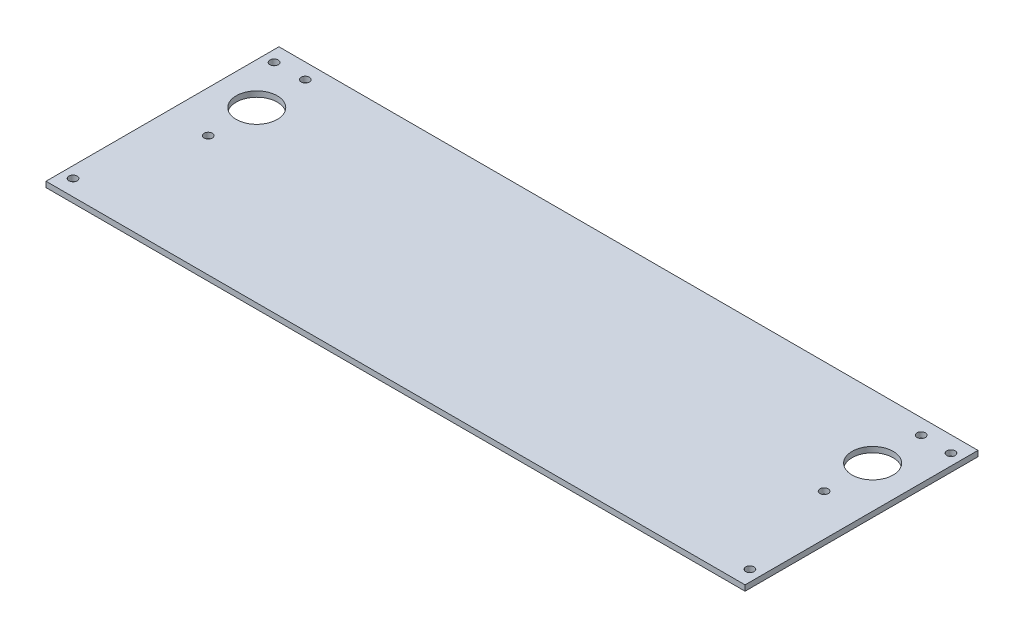
from build123d import *

# Parameters (mm, degrees)
SKETCH_1_W         = 252.1
SKETCH_1_H         = 84
EXTRUDE_1_DEPTH    = 1
SKETCH1_R          = 1.5
CUT_EXTRUDE1_DEPTH = 10
SKETCH4_R          = 7.4
CUT_EXTRUDE3_DEPTH = 133.878149069
SKETCH5_R          = 1.5
CUT_EXTRUDE4_DEPTH = 10


with BuildPart() as part:
    # 草图1 → 凸台-拉伸1 (new, symmetric)
    with BuildSketch(Plane(origin=(0, 0, 0), x_dir=(1, 0, 0), z_dir=(0, 1, 0))):
        Rectangle(SKETCH_1_W, SKETCH_1_H)
    extrude(amount=EXTRUDE_1_DEPTH, both=True)

    # Sketch1 → Cut-Extrude1 (cut)
    with BuildSketch(Plane(origin=(0, 1, 0), x_dir=(1, 0, 0), z_dir=(0, 1, 0))):
        with Locations(Location((-122.05, 36.25, 0), (0, 0, 270))):
            Circle(SKETCH1_R)
        with Locations(Location((-122.05, -36.25, 0), (0, 0, 270))):
            Circle(SKETCH1_R)
        with Locations(Location((122.05, -36.25, 0), (0, 0, 270))):
            Circle(SKETCH1_R)
        with Locations(Location((122.05, 36.25, 0), (0, 0, 270))):
            Circle(SKETCH1_R)
    extrude(amount=-CUT_EXTRUDE1_DEPTH, mode=Mode.SUBTRACT)

    # Sketch4 → Cut-Extrude3 (cut, through all)
    with BuildSketch(Plane(origin=(0, 1, 0), x_dir=(1, 0, 0), z_dir=(0, 1, 0))):
        with Locations(Location((-111.05, 19, 0), (0, 0, 270))):
            Circle(SKETCH4_R)
        with Locations(Location((111.05, 19, 0), (0, 0, 270))):
            Circle(SKETCH4_R)
    extrude(amount=-CUT_EXTRUDE3_DEPTH, mode=Mode.SUBTRACT)

    # Sketch5 → Cut-Extrude4 (cut)
    with BuildSketch(Plane(origin=(0, 1, 0), x_dir=(1, 0, 0), z_dir=(0, 1, 0))):
        with Locations(Location((-111.05, 1.5, 0), (0, 0, 270))):
            Circle(SKETCH5_R)
        with Locations(Location((-111.05, 36.5, 0), (0, 0, 270))):
            Circle(SKETCH5_R)
        with Locations(Location((111.05, 1.5, 0), (0, 0, 270))):
            Circle(SKETCH5_R)
        with Locations(Location((111.05, 36.5, 0), (0, 0, 270))):
            Circle(SKETCH5_R)
    extrude(amount=-CUT_EXTRUDE4_DEPTH, mode=Mode.SUBTRACT)


solid = part.part
